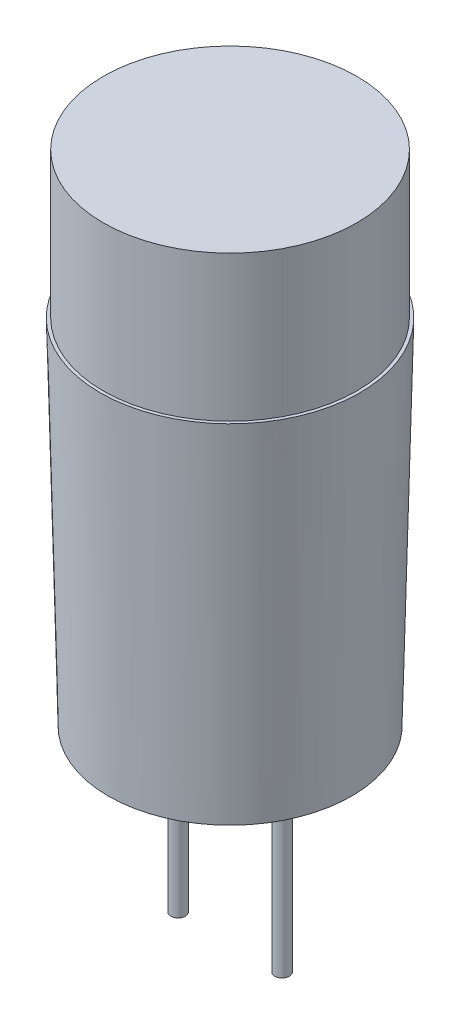
from build123d import *

# Parameters (mm, degrees)
SKETCH2_R           = 6.1
BOSS_EXTRUDE1_DEPTH = 7
SKETCH3_R           = 0.35
BOSS_EXTRUDE2_DEPTH = 9


with BuildPart() as part:
    # Sketch1 → Revolve1 (revolve)
    with BuildSketch(Plane.XY, mode=Mode.PRIVATE) as revolve1_sk:
        Polygon((0, 0), (6.25, 0), (5.85, -17), (0, -17), align=None)
    revolve(revolve1_sk.sketch.rotate(Axis((0, 0, 0), (0, -1, 0)), 90), axis=Axis((0, 0, 0), (0, -1, 0)))

    # Sketch2 → Boss-Extrude1 (add)
    with BuildSketch(Plane(origin=(0, 0, 0), x_dir=(1, 0, 0), z_dir=(0, 1, 0))):
        with Locations(Location((0, 0, 0), (0, 0, 90))):
            Circle(SKETCH2_R)
    extrude(amount=BOSS_EXTRUDE1_DEPTH)

    # Sketch3 → Boss-Extrude2 (add)
    with BuildSketch(Plane.XZ.offset(17)):
        with Locations(Location((-2.5, 0, 0), (0, 0, 90))):
            Circle(SKETCH3_R)
        with Locations(Location((2.5, 0, 0), (0, 0, 90))):
            Circle(SKETCH3_R)
    extrude(amount=BOSS_EXTRUDE2_DEPTH)


solid = part.part
